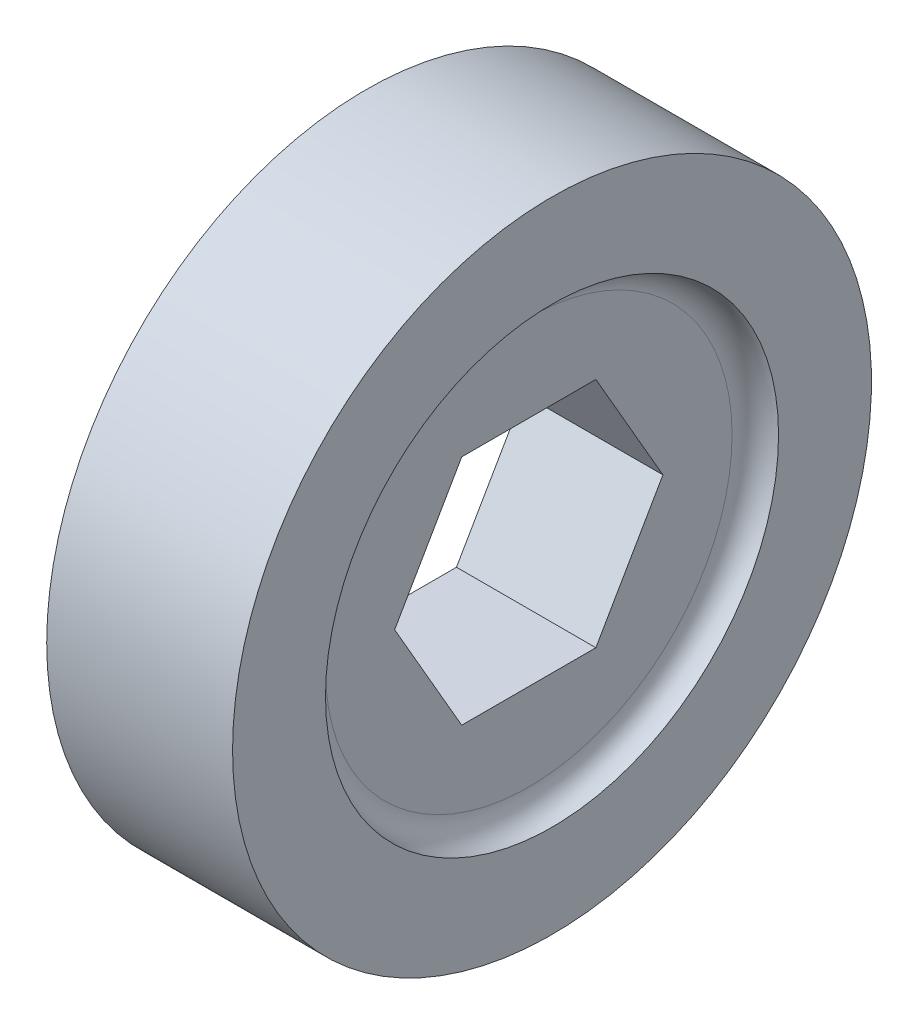
from build123d import *

# Parameters (mm, degrees)
CUT_EXTRUDE1_REACH = 28.247


with BuildPart() as part:
    # Sketch2 → Revolve1 (revolve)
    with BuildSketch(Plane.XY, mode=Mode.PRIVATE) as revolve1_sk:
        with BuildLine():
            Line((-5.08, 17.4625), (-5.08, 12.3825))
            ThreePointArc((-5.08, 12.3825), (-4.181974388, 12.010525612), (-3.81, 11.1125))
            Line((-3.81, 11.1125), (-3.81, 0))
            Line((-3.81, 0), (3.81, 0))
            Line((3.81, 0), (3.81, 11.1125))
            ThreePointArc((3.81, 11.1125), (4.181974388, 12.010525612), (5.08, 12.3825))
            Line((5.08, 12.3825), (5.08, 17.4625))
            Line((5.08, 17.4625), (-5.08, 17.4625))
        make_face()
    revolve(revolve1_sk.sketch.rotate(Axis((-6.869429095, 0, 0), (1, 0, 0)), 90), axis=Axis((-6.869429095, 0, 0), (1, 0, 0)))

    # Sketch3 → Cut-Extrude1 (cut, up to next)
    with BuildSketch(Plane(origin=(3.81, 0, 0), x_dir=(0, 0, -1), z_dir=(1, 0, 0)), mode=Mode.PRIVATE) as cut_extrude1_sk1:
        Polygon((7.332348419, 0), (3.666174209, 6.35), (-3.666174209, 6.35), (-7.332348419, 0), (-3.666174209, -6.35), (3.666174209, -6.35), align=None)
    cut_extrude1_tool1 = extrude(cut_extrude1_sk1.sketch, amount=-CUT_EXTRUDE1_REACH, mode=Mode.PRIVATE) & part.part
    add(cut_extrude1_tool1.solids().sort_by_distance((3.81, 0, 0))[0], mode=Mode.SUBTRACT)


solid = part.part
